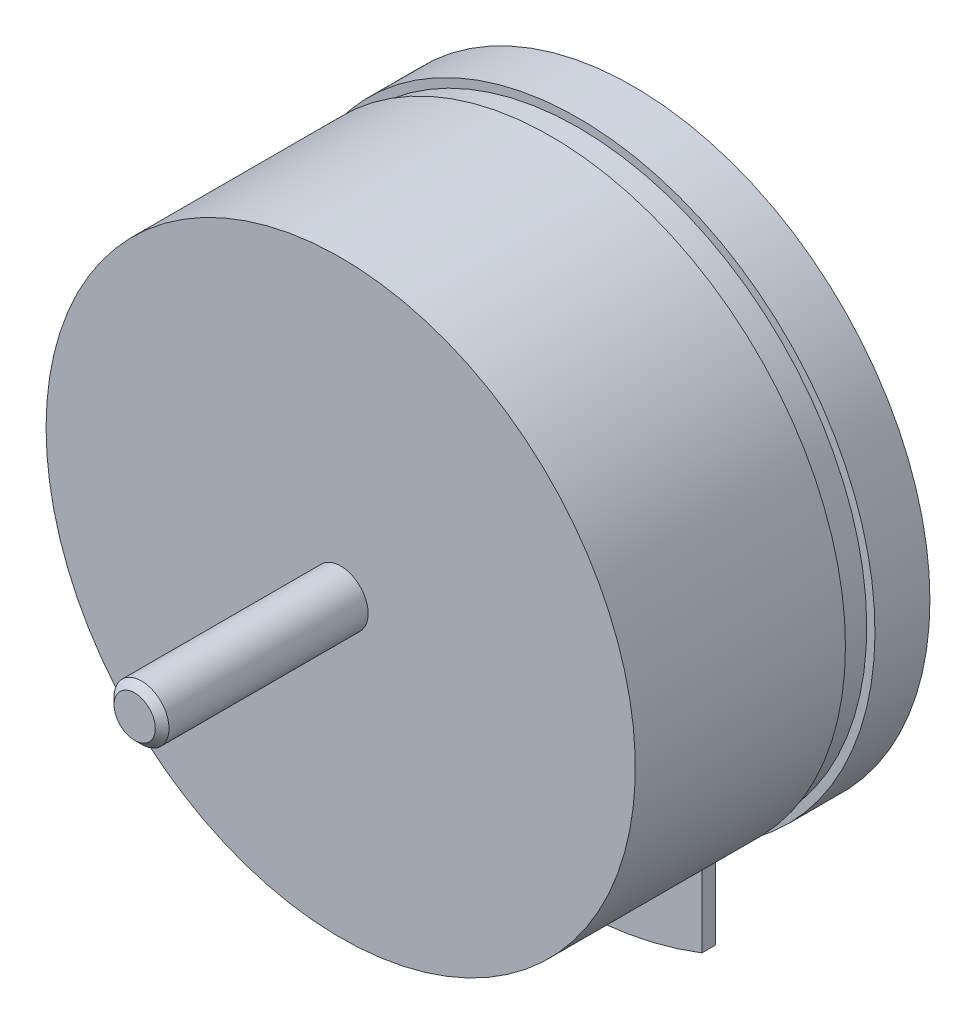
from build123d import *

# Parameters (mm, degrees)
SKETCH_1_R               = 21.6
EXTRUDE_1_DEPTH          = 4
SKETCH_6_R               = 21.45
EXTRUDE_6_DEPTH          = 21.3
SKETCH_2_R               = 2
EXTRUDE_2_DEPTH          = 15
SKETCH_3_R               = 1.25
CUT_EXTRUDE_3_DEPTH      = 3.9
PATTERN_CIRCULAR_1_COUNT = 3
SKETCH_4_R               = 6
EXTRUDE_4_DEPTH          = 3.2
EXTRUDE_START            = 7.8
SKETCH_5_R               = 2
EXTRUDE_5_DEPTH          = 7.8
SKETCH_7_R               = 21.45
SKETCH_7_R_2             = 21
CUT_EXTRUDE_7_DEPTH      = 2
EXTRUDE_9_DEPTH          = 1
CHAMFER_1_SIZE           = 0.5


with BuildPart() as part:
    # 草图1 → 拉伸1 (new body)
    with BuildSketch(Plane.XY):
        Circle(SKETCH_1_R)
    extrude(amount=EXTRUDE_1_DEPTH)

    # 草图6 → 拉伸6 (add)
    with BuildSketch(Plane(origin=(0, 0, 0), x_dir=(-1, 0, 0), z_dir=(0, 0, -1))):
        Circle(SKETCH_6_R)
    extrude(amount=-EXTRUDE_6_DEPTH)

    # 草图2 → 拉伸2 (add)
    with BuildSketch(Plane.XY.offset(21.3)):
        with Locations(Location((0, 0, 0), (0, 0, 180))):
            Circle(SKETCH_2_R)
    extrude(amount=EXTRUDE_2_DEPTH)

    # 草图3 → 拉伸3 (cut)
    with BuildSketch(Plane(origin=(0, 0, 0), x_dir=(-1, 0, 0), z_dir=(0, 0, -1))):
        with Locations((0, 11)):
            Circle(SKETCH_3_R)
    cut_extrude_3 = extrude(amount=-CUT_EXTRUDE_3_DEPTH, mode=Mode.SUBTRACT)

    # 阵列(圆周)1: 拉伸3 ×3 about axis
    pattern_circular_1_axis = Axis((0, 0, 0), (0, 0, 1))
    for i in range(1, PATTERN_CIRCULAR_1_COUNT):
        add(cut_extrude_3.rotate(pattern_circular_1_axis, i * 360 / PATTERN_CIRCULAR_1_COUNT), mode=Mode.SUBTRACT)

    # 草图4 → 拉伸4 (add)
    with BuildSketch(Plane(origin=(0, 0, 0), x_dir=(-1, 0, 0), z_dir=(0, 0, -1))):
        with Locations(Location((0, 0, 0), (0, 0, 180))):
            Circle(SKETCH_4_R)
    extrude(amount=EXTRUDE_4_DEPTH)

    # 草图5 → 拉伸5 (add)
    with BuildSketch(Plane(origin=(0, 0, -3.2), x_dir=(-1, 0, 0), z_dir=(0, 0, -1)).offset(EXTRUDE_START)):
        Circle(SKETCH_5_R)
    extrude(amount=-EXTRUDE_5_DEPTH)

    # 草图7 → 拉伸7 (cut)
    with BuildSketch(Plane.XY.offset(4)):
        with Locations(Location((0, 0, 0), (0, 0, 180))):
            Circle(SKETCH_7_R)
        Circle(SKETCH_7_R_2, mode=Mode.SUBTRACT)
    extrude(amount=CUT_EXTRUDE_7_DEPTH, mode=Mode.SUBTRACT)

    # 草图9 → 拉伸9 (add)
    with BuildSketch(Plane.XY.offset(4)):
        with BuildLine():
            Line((-10, -18.466185313), (10, -18.466185313))
            Line((10, -18.466185313), (10, -25.545340812))
            ThreePointArc((10, -25.545340812), (0, -27.432907925), (-10, -25.545340812))
            Line((-10, -25.545340812), (-10, -18.466185313))
        make_face()
    extrude(amount=EXTRUDE_9_DEPTH)

    # 倒角1
    chamfer_1_edges = [part.edges().sort_by_distance(p)[0] for p in [
        (2, 0, 36.3),
        (2, 0, -11),
    ]]
    chamfer(chamfer_1_edges, length=CHAMFER_1_SIZE)


solid = part.part
